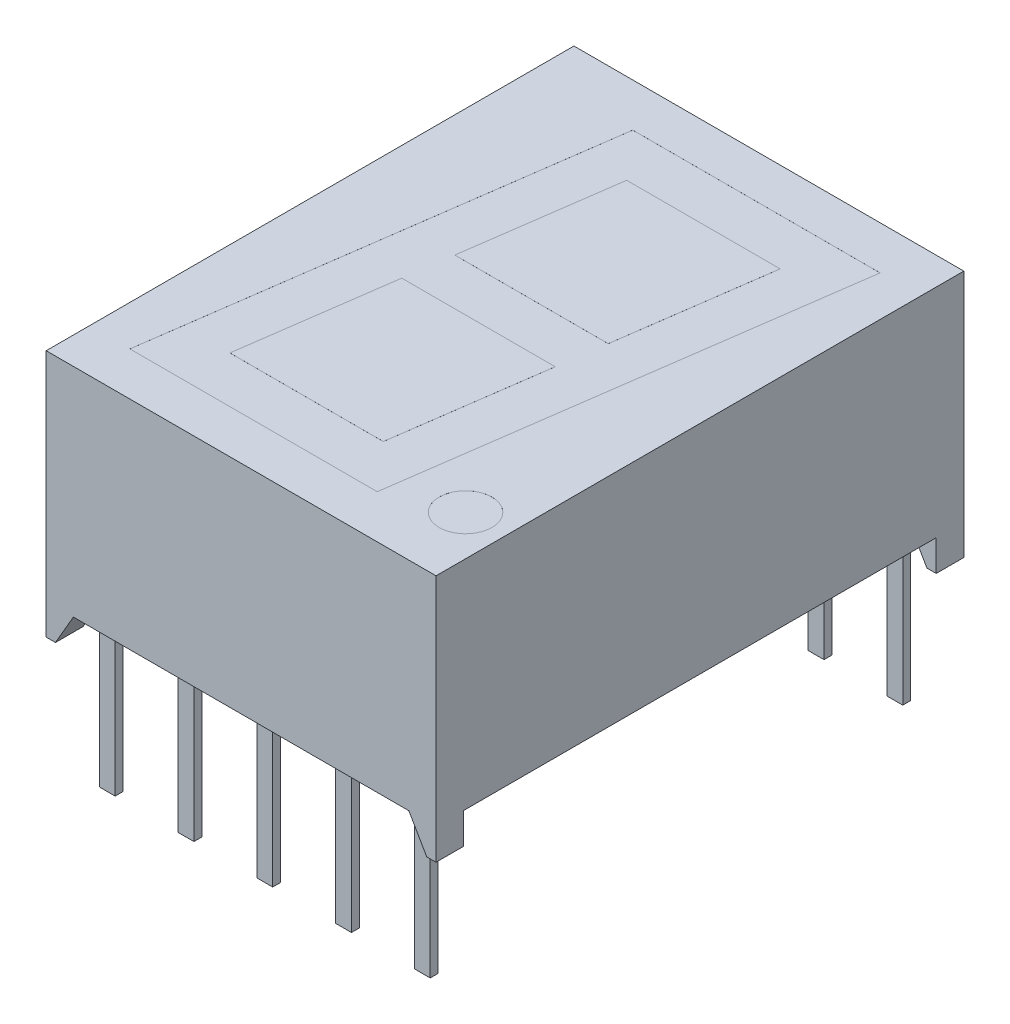
from build123d import *

# Parameters (mm, degrees)
EXTRUDE1_DEPTH          = 6.2865
SKETCH4_R               = 0.85
CUT_EXTRUDE1_DEPTH      = 0.001
CUT_EXTRUDE2_DEPTH      = 14.264244504
CUT_EXTRUDE2_DEPTH_BACK = 14.264244504
SKETCH2_W               = 0.51
SKETCH2_H               = 0.254
EXTRUDE2_DEPTH          = 5.09
LPATTERN1_COUNT         = 3
LPATTERN1_PITCH         = 2.54
LPATTERN1_COL_COUNT     = 3
LPATTERN1_COL_PITCH     = 2.54


with BuildPart() as part:
    # Sketch1 → Extrude1 (new, symmetric)
    with BuildSketch(Plane(origin=(0, 0, 0), x_dir=(0, 0, -1), z_dir=(1, 0, 0))):
        Polygon((-8.51, 0), (8.51, 0), (8.51, -8), (7.62, -8), (7.62, -7), (-7.62, -7), (-7.62, -8), (-8.51, -8), align=None)
    extrude(amount=EXTRUDE1_DEPTH, both=True)

    # Sketch4 → Cut-Extrude1 (cut)
    # profile 1 of 2: a face of its own
    with BuildSketch(Plane(origin=(0, 0, 0), x_dir=(-1, 0, 0), z_dir=(0, 1, 0))):
        with Locations(Location((-4.988064246, 6.26, 0), (0, 0, 90))):
            Circle(SKETCH4_R)
    # profile 2 of 2: a face of its own
    with BuildSketch(Plane(origin=(0, 0, 0), x_dir=(-1, 0, 0), z_dir=(0, 1, 0))):
        Polygon((4.988064246, 7.11), (2.989573577, -7.11), (-4.988064246, -7.11), (-2.989573577, 7.11), align=None)
        Polygon((-1.68564347, 5.61), (3.262511635, 5.61), (2.579483179, 0.75), (-2.368671927, 0.75), align=None, mode=Mode.SUBTRACT)
        Polygon((-3.262511635, -5.61), (-2.579483179, -0.75), (2.368671927, -0.75), (1.68564347, -5.61), align=None, mode=Mode.SUBTRACT)
    extrude(amount=-CUT_EXTRUDE1_DEPTH, mode=Mode.SUBTRACT)

    # Sketch5 → Cut-Extrude2 (cut, two sides: drawn at the far end of the back side and taken through both)
    with BuildSketch(Plane.XY.offset(-CUT_EXTRUDE2_DEPTH_BACK)):
        Polygon((-5.9865, -8), (-5.409149731, -7), (5.409149731, -7), (5.9865, -8), align=None)
    extrude(amount=CUT_EXTRUDE2_DEPTH + CUT_EXTRUDE2_DEPTH_BACK, mode=Mode.SUBTRACT)

    # Sketch2 → Extrude2 (add)
    with BuildSketch(Plane.XZ.offset(7)):
        with Locations((0, 7.62)):
            Rectangle(SKETCH2_W, SKETCH2_H)
        with Locations((0, -7.62)):
            Rectangle(SKETCH2_W, SKETCH2_H)
    extrude2 = extrude(amount=EXTRUDE2_DEPTH)

    # LPattern1: Extrude2 ×3
    with Locations(*[(i * LPATTERN1_PITCH, 0, 0) for i in range(1, LPATTERN1_COUNT)]):
        add(extrude2)

    # LPattern1 col: Extrude2 ×3
    with Locations(*[(-i * LPATTERN1_COL_PITCH, 0, 0) for i in range(1, LPATTERN1_COL_COUNT)]):
        add(extrude2)


solid = part.part
